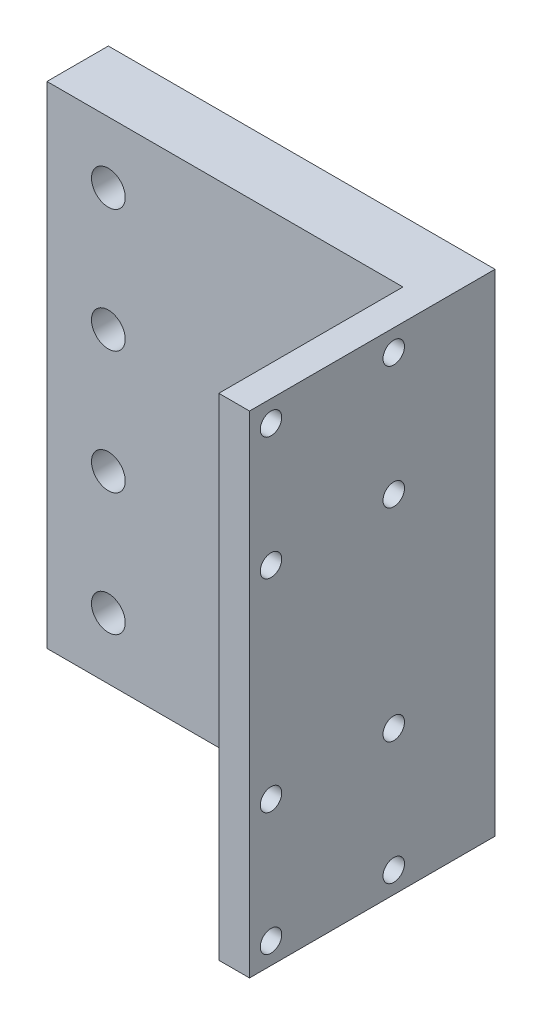
from build123d import *

# Parameters (mm, degrees)
ESQUISSE1_W             = 63
ESQUISSE1_H             = 80
ESQUISSE1_R             = 2.75
BOSS_EXTRU_1_DEPTH      = 10
ESQUISSE2_W             = 5
ESQUISSE2_H             = 80
BOSS_EXTRU_2_DEPTH      = 30
ENL_V_MAT_EXTRU_1_REACH = 95.09
ESQUISSE3_R             = 1.75
ESQUISSE4_R             = 6
ENL_V_MAT_EXTRU_2_DEPTH = 5


with BuildPart() as part:
    # Esquisse1 → Boss.-Extru.1 (new body)
    with BuildSketch(Plane.XY):
        with Locations((-1.896872358, -15.648351648)):
            Rectangle(ESQUISSE1_W, ESQUISSE1_H)
        with Locations((-23.396872358, 14.351648352)):
            Circle(ESQUISSE1_R, mode=Mode.SUBTRACT)
        with Locations((-23.396872358, -5.648351648)):
            Circle(ESQUISSE1_R, mode=Mode.SUBTRACT)
        with Locations((-23.396872358, -25.648351648)):
            Circle(ESQUISSE1_R, mode=Mode.SUBTRACT)
        with Locations((-23.396872358, -45.648351648)):
            Circle(ESQUISSE1_R, mode=Mode.SUBTRACT)
    extrude(amount=BOSS_EXTRU_1_DEPTH)

    # Esquisse2 → Boss.-Extru.2 (add)
    with BuildSketch(Plane(origin=(0, 0, 10), x_dir=(-1, 0, 0), z_dir=(0, 0, -1))):
        with Locations((-27.103127642, -15.648351648)):
            Rectangle(ESQUISSE2_W, ESQUISSE2_H)
    extrude(amount=-BOSS_EXTRU_2_DEPTH)

    # Esquisse3 → Enlèv. mat.-Extru.1 (cut, up to next)
    with BuildSketch(Plane(origin=(29.603127642, 0, 0), x_dir=(0, 0, -1), z_dir=(1, 0, 0)), mode=Mode.PRIVATE) as enl_v_mat_extru_1_sk1:
        with Locations(Location((-36.5, -52.148351648, 0), (0, 0, 90))):
            Circle(ESQUISSE3_R)
    enl_v_mat_extru_1_tool1 = extrude(enl_v_mat_extru_1_sk1.sketch, amount=-ENL_V_MAT_EXTRU_1_REACH, mode=Mode.PRIVATE) & part.part
    # Esquisse3 → Enlèv. mat.-Extru.1 (cut, up to next)
    with BuildSketch(Plane(origin=(29.603127642, 0, 0), x_dir=(0, 0, -1), z_dir=(1, 0, 0)), mode=Mode.PRIVATE) as enl_v_mat_extru_1_sk2:
        with Locations(Location((-36.5, -32.148351648, 0), (0, 0, 90))):
            Circle(ESQUISSE3_R)
    enl_v_mat_extru_1_tool2 = extrude(enl_v_mat_extru_1_sk2.sketch, amount=-ENL_V_MAT_EXTRU_1_REACH, mode=Mode.PRIVATE) & part.part
    # Esquisse3 → Enlèv. mat.-Extru.1 (cut, up to next)
    with BuildSketch(Plane(origin=(29.603127642, 0, 0), x_dir=(0, 0, -1), z_dir=(1, 0, 0)), mode=Mode.PRIVATE) as enl_v_mat_extru_1_sk3:
        with Locations(Location((-16.5, -32.148351648, 0), (0, 0, 90))):
            Circle(ESQUISSE3_R)
    enl_v_mat_extru_1_tool3 = extrude(enl_v_mat_extru_1_sk3.sketch, amount=-ENL_V_MAT_EXTRU_1_REACH, mode=Mode.PRIVATE) & part.part
    # Esquisse3 → Enlèv. mat.-Extru.1 (cut, up to next)
    with BuildSketch(Plane(origin=(29.603127642, 0, 0), x_dir=(0, 0, -1), z_dir=(1, 0, 0)), mode=Mode.PRIVATE) as enl_v_mat_extru_1_sk4:
        with Locations(Location((-16.5, -52.148351648, 0), (0, 0, 90))):
            Circle(ESQUISSE3_R)
    enl_v_mat_extru_1_tool4 = extrude(enl_v_mat_extru_1_sk4.sketch, amount=-ENL_V_MAT_EXTRU_1_REACH, mode=Mode.PRIVATE) & part.part
    # Esquisse3 → Enlèv. mat.-Extru.1 (cut, up to next)
    with BuildSketch(Plane(origin=(29.603127642, 0, 0), x_dir=(0, 0, -1), z_dir=(1, 0, 0)), mode=Mode.PRIVATE) as enl_v_mat_extru_1_sk5:
        with Locations(Location((-36.5, 0.851648352, 0), (0, 0, 90))):
            Circle(ESQUISSE3_R)
    enl_v_mat_extru_1_tool5 = extrude(enl_v_mat_extru_1_sk5.sketch, amount=-ENL_V_MAT_EXTRU_1_REACH, mode=Mode.PRIVATE) & part.part
    # Esquisse3 → Enlèv. mat.-Extru.1 (cut, up to next)
    with BuildSketch(Plane(origin=(29.603127642, 0, 0), x_dir=(0, 0, -1), z_dir=(1, 0, 0)), mode=Mode.PRIVATE) as enl_v_mat_extru_1_sk6:
        with Locations(Location((-36.5, 20.851648352, 0), (0, 0, 90))):
            Circle(ESQUISSE3_R)
    enl_v_mat_extru_1_tool6 = extrude(enl_v_mat_extru_1_sk6.sketch, amount=-ENL_V_MAT_EXTRU_1_REACH, mode=Mode.PRIVATE) & part.part
    # Esquisse3 → Enlèv. mat.-Extru.1 (cut, up to next)
    with BuildSketch(Plane(origin=(29.603127642, 0, 0), x_dir=(0, 0, -1), z_dir=(1, 0, 0)), mode=Mode.PRIVATE) as enl_v_mat_extru_1_sk7:
        with Locations(Location((-16.5, 20.851648352, 0), (0, 0, 90))):
            Circle(ESQUISSE3_R)
    enl_v_mat_extru_1_tool7 = extrude(enl_v_mat_extru_1_sk7.sketch, amount=-ENL_V_MAT_EXTRU_1_REACH, mode=Mode.PRIVATE) & part.part
    # Esquisse3 → Enlèv. mat.-Extru.1 (cut, up to next)
    with BuildSketch(Plane(origin=(29.603127642, 0, 0), x_dir=(0, 0, -1), z_dir=(1, 0, 0)), mode=Mode.PRIVATE) as enl_v_mat_extru_1_sk8:
        with Locations(Location((-16.5, 0.851648352, 0), (0, 0, 90))):
            Circle(ESQUISSE3_R)
    enl_v_mat_extru_1_tool8 = extrude(enl_v_mat_extru_1_sk8.sketch, amount=-ENL_V_MAT_EXTRU_1_REACH, mode=Mode.PRIVATE) & part.part
    add(enl_v_mat_extru_1_tool1.solids().sort_by_distance((29.603128, -52.148352, 36.5))[0], mode=Mode.SUBTRACT)
    add(enl_v_mat_extru_1_tool2.solids().sort_by_distance((29.603128, -32.148352, 36.5))[0], mode=Mode.SUBTRACT)
    add(enl_v_mat_extru_1_tool3.solids().sort_by_distance((29.603128, -32.148352, 16.5))[0], mode=Mode.SUBTRACT)
    add(enl_v_mat_extru_1_tool4.solids().sort_by_distance((29.603128, -52.148352, 16.5))[0], mode=Mode.SUBTRACT)
    add(enl_v_mat_extru_1_tool5.solids().sort_by_distance((29.603128, 0.851648, 36.5))[0], mode=Mode.SUBTRACT)
    add(enl_v_mat_extru_1_tool6.solids().sort_by_distance((29.603128, 20.851648, 36.5))[0], mode=Mode.SUBTRACT)
    add(enl_v_mat_extru_1_tool7.solids().sort_by_distance((29.603128, 20.851648, 16.5))[0], mode=Mode.SUBTRACT)
    add(enl_v_mat_extru_1_tool8.solids().sort_by_distance((29.603128, 0.851648, 16.5))[0], mode=Mode.SUBTRACT)

    # Esquisse4 → Enlèv. mat.-Extru.2 (cut)
    with BuildSketch(Plane(origin=(0, 0, 0), x_dir=(-1, 0, 0), z_dir=(0, 0, -1))):
        with Locations((23.396872358, -45.648351648)):
            Circle(ESQUISSE4_R)
        with Locations((23.396872358, -25.648351648)):
            Circle(ESQUISSE4_R)
        with Locations((23.396872358, -5.648351648)):
            Circle(ESQUISSE4_R)
        with Locations((23.396872358, 14.351648352)):
            Circle(ESQUISSE4_R)
    extrude(amount=-ENL_V_MAT_EXTRU_2_DEPTH, mode=Mode.SUBTRACT)


solid = part.part
